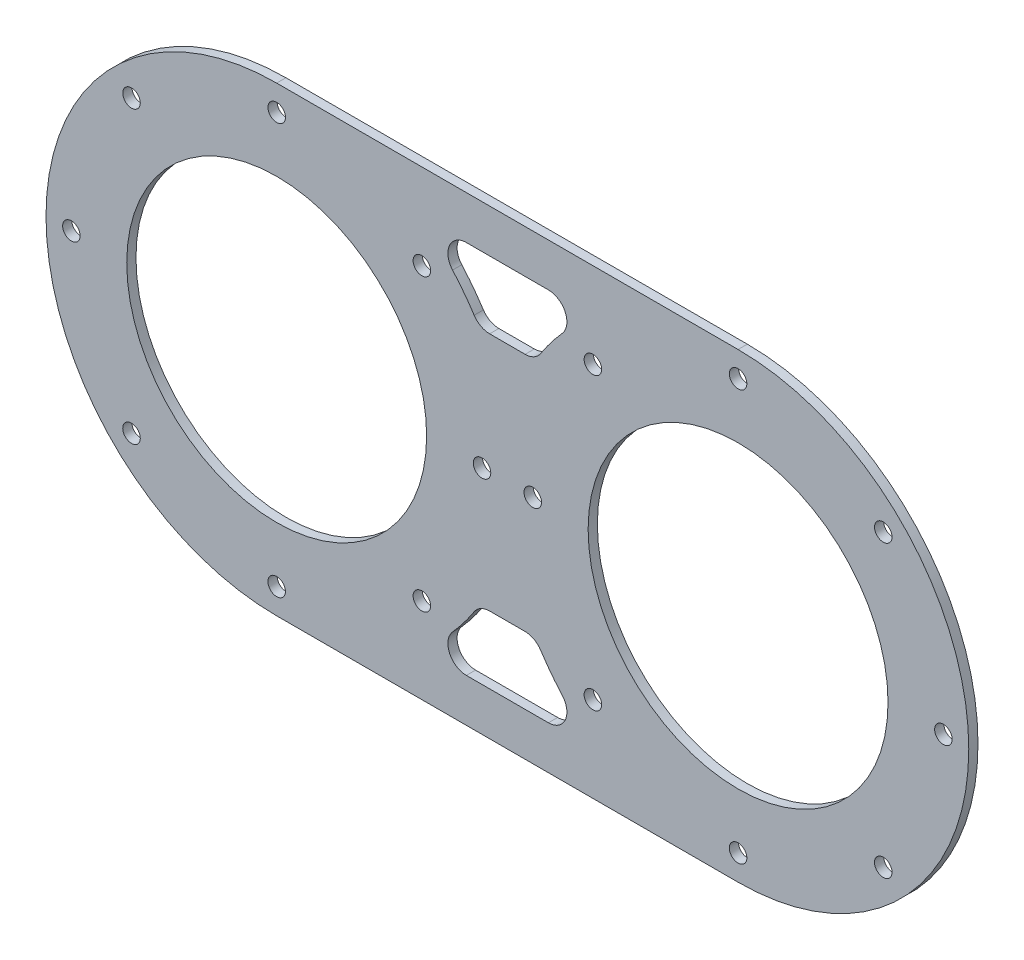
from build123d import *

# Parameters (mm, degrees)
SKETCH_1_R          = 32.5
EXTRUDE_1_DEPTH     = 2
FILLET_1_R          = 4
SKETCH_2_R          = 1.9
CUT_EXTRUDE_1_DEPTH = 10


with BuildPart() as part:
    # 草图1 → 凸台-拉伸1 (new body)
    with BuildSketch(Plane.XY):
        with BuildLine():
            Line((-50, 50), (-25, 50))
            Line((-25, 50), (25, 50))
            Line((25, 50), (50, 50))
            ThreePointArc((50, 50), (100, 0), (50, -50))
            Line((50, -50), (25, -50))
            Line((25, -50), (-25, -50))
            Line((-25, -50), (-50, -50))
            ThreePointArc((-50, -50), (-100, 0), (-50, 50))
        make_face()
        with Locations((-50, 0)):
            Circle(SKETCH_1_R, mode=Mode.SUBTRACT)
        with Locations((50, 0)):
            Circle(SKETCH_1_R, mode=Mode.SUBTRACT)
        with BuildLine():
            Line((-6.07127469, -26.015246236), (6.07127469, -26.015246236))
            ThreePointArc((6.07127469, -26.015246236), (11.868149575, -33.948312584), (19.077305008, -40.624043109))
            Line((19.077305008, -40.624043109), (-19.077305008, -40.624043109))
            ThreePointArc((-19.077305008, -40.624043109), (-11.868149575, -33.948312584), (-6.07127469, -26.015246236))
        make_face(mode=Mode.SUBTRACT)
        with BuildLine():
            Line((19.077305008, 40.624043109), (-19.077305008, 40.624043109))
            ThreePointArc((-19.077305008, 40.624043109), (-11.868149575, 33.948312584), (-6.07127469, 26.015246236))
            Line((-6.07127469, 26.015246236), (6.07127469, 26.015246236))
            ThreePointArc((6.07127469, 26.015246236), (11.868149575, 33.948312584), (19.077305008, 40.624043109))
        make_face(mode=Mode.SUBTRACT)
    extrude(amount=EXTRUDE_1_DEPTH)

    # 圆角1
    fillet_1_edges = [part.edges().sort_by_distance(p)[0] for p in [
        (-6.07127469, -26.015246236, 1),
        (-19.077305008, -40.624043109, 1),
        (19.077305008, -40.624043109, 1),
        (6.07127469, -26.015246236, 1),
        (6.07127469, 26.015246236, 1),
        (19.077305008, 40.624043109, 1),
        (-19.077305008, 40.624043109, 1),
        (-6.07127469, 26.015246236, 1),
    ]]
    fillet(fillet_1_edges, radius=FILLET_1_R)

    # 草图2 → 切除-拉伸1 (cut)
    with BuildSketch(Plane.XY.offset(2)):
        with Locations((94.5, 0)):
            Circle(SKETCH_2_R)
        with Locations((81.466251763, -31.466251763)):
            Circle(SKETCH_2_R)
        with Locations((50, -44.5)):
            Circle(SKETCH_2_R)
        with Locations((18.533748237, -31.466251763)):
            Circle(SKETCH_2_R)
        with Locations((5.5, 0)):
            Circle(SKETCH_2_R)
        with Locations((18.533748237, 31.466251763)):
            Circle(SKETCH_2_R)
        with Locations((50, 44.5)):
            Circle(SKETCH_2_R)
        with Locations((81.466251763, 31.466251763)):
            Circle(SKETCH_2_R)
        with Locations((-81.466251763, 31.466251763)):
            Circle(SKETCH_2_R)
        with Locations((-50, 44.5)):
            Circle(SKETCH_2_R)
        with Locations((-18.533748237, 31.466251763)):
            Circle(SKETCH_2_R)
        with Locations((-5.5, 0)):
            Circle(SKETCH_2_R)
        with Locations((-18.533748237, -31.466251763)):
            Circle(SKETCH_2_R)
        with Locations((-50, -44.5)):
            Circle(SKETCH_2_R)
        with Locations((-81.466251763, -31.466251763)):
            Circle(SKETCH_2_R)
        with Locations((-94.5, 0)):
            Circle(SKETCH_2_R)
    extrude(amount=-CUT_EXTRUDE_1_DEPTH, mode=Mode.SUBTRACT)


solid = part.part
